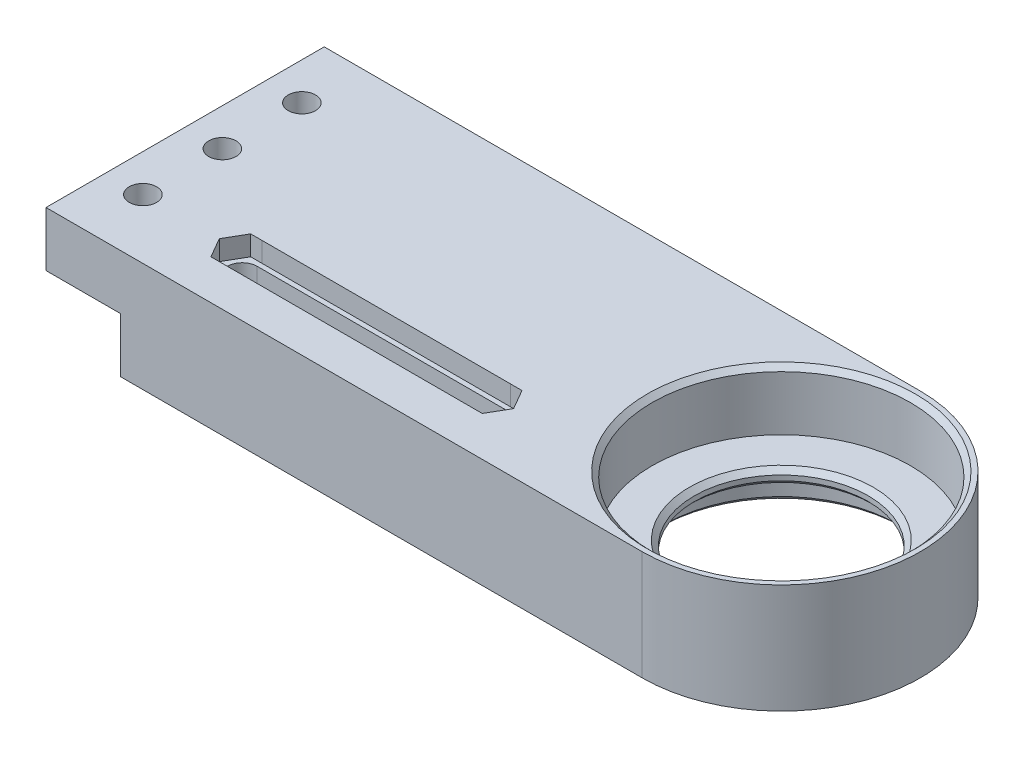
from build123d import *

# Parameters (mm, degrees)
EXTRUDE_1_DEPTH     = 22
CUT_EXTRUDE_1_REACH = 136.239
SKETCH_2_W          = 15
SKETCH_2_H          = 11
SKETCH_3_R          = 26
CUT_EXTRUDE_2_DEPTH = 12
CUT_EXTRUDE_3_REACH = 125.806
SKETCH_4_R          = 17.5
SKETCH_5_R          = 23.5
CUT_EXTRUDE_4_DEPTH = 7
CHAMFER_1_SIZE      = 1
CUT_EXTRUDE_5_REACH = 127.172
SKETCH_6_R          = 2.75
CUT_EXTRUDE_7_REACH = 127.172
CUT_EXTRUDE_8_DEPTH = 4


with BuildPart() as part:
    # 草图1 → 凸台-拉伸1 (new body)
    with BuildSketch(Plane(origin=(0, 0, 0), x_dir=(1, 0, 0), z_dir=(0, 1, 0))):
        with BuildLine():
            Line((0, 28), (-120, 28))
            Line((-120, 28), (-120, -28))
            Line((-120, -28), (0, -28))
            ThreePointArc((0, -28), (28, 0), (0, 28))
        make_face()
    extrude(amount=EXTRUDE_1_DEPTH)

    # 草图2 → 切除-拉伸1 (cut, up to next)
    with BuildSketch(Plane.XY.offset(28), mode=Mode.PRIVATE) as cut_extrude_1_sk1:
        with Locations((-112.5, 5.5)):
            Rectangle(SKETCH_2_W, SKETCH_2_H)
    cut_extrude_1_tool1 = extrude(cut_extrude_1_sk1.sketch, amount=-CUT_EXTRUDE_1_REACH, mode=Mode.PRIVATE) & part.part
    add(cut_extrude_1_tool1.solids().sort_by_distance((-112.5, 5.5, 28))[0], mode=Mode.SUBTRACT)

    # 草图3 → 切除-拉伸2 (cut)
    with BuildSketch(Plane(origin=(0, 22, 0), x_dir=(1, 0, 0), z_dir=(0, 1, 0))):
        with Locations(Location((0, 0, 0), (0, 0, 270))):
            Circle(SKETCH_3_R)
    extrude(amount=-CUT_EXTRUDE_2_DEPTH, mode=Mode.SUBTRACT)

    # 草图4 → 切除-拉伸3 (cut, up to next)
    with BuildSketch(Plane(origin=(0, 10, 0), x_dir=(1, 0, 0), z_dir=(0, 1, 0)), mode=Mode.PRIVATE) as cut_extrude_3_sk1:
        with Locations(Location((0, 0, 0), (0, 0, 270))):
            Circle(SKETCH_4_R)
    cut_extrude_3_tool1 = extrude(cut_extrude_3_sk1.sketch, amount=-CUT_EXTRUDE_3_REACH, mode=Mode.PRIVATE) & part.part
    add(cut_extrude_3_tool1.solids().sort_by_distance((0, 10, 0))[0], mode=Mode.SUBTRACT)

    # 草图5 → 切除-拉伸4 (cut)
    with BuildSketch(Plane.XZ):
        with Locations(Location((0, 0, 0), (0, 0, 270))):
            Circle(SKETCH_5_R)
    extrude(amount=-CUT_EXTRUDE_4_DEPTH, mode=Mode.SUBTRACT)

    # 倒角1
    chamfer_1_edges = [part.edges().sort_by_distance(p)[0] for p in [
        (0, 22, -26),
        (0, 10, -17.5),
        (0, 0, 23.5),
        (0, 7, -17.5),
    ]]
    chamfer(chamfer_1_edges, length=CHAMFER_1_SIZE)

    # 草图6 → 切除-拉伸5 (cut, up to next)
    with BuildSketch(Plane(origin=(0, 22, 0), x_dir=(1, 0, 0), z_dir=(0, 1, 0)), mode=Mode.PRIVATE) as cut_extrude_5_sk1:
        with Locations(Location((-112.5, 0, 0), (0, 0, 270))):
            Circle(SKETCH_6_R)
    cut_extrude_5_tool1 = extrude(cut_extrude_5_sk1.sketch, amount=-CUT_EXTRUDE_5_REACH, mode=Mode.PRIVATE) & part.part
    # 草图6 → 切除-拉伸5 (cut, up to next)
    with BuildSketch(Plane(origin=(0, 22, 0), x_dir=(1, 0, 0), z_dir=(0, 1, 0)), mode=Mode.PRIVATE) as cut_extrude_5_sk2:
        with Locations(Location((-112.5, 16, 0), (0, 0, 270))):
            Circle(SKETCH_6_R)
    cut_extrude_5_tool2 = extrude(cut_extrude_5_sk2.sketch, amount=-CUT_EXTRUDE_5_REACH, mode=Mode.PRIVATE) & part.part
    # 草图6 → 切除-拉伸5 (cut, up to next)
    with BuildSketch(Plane(origin=(0, 22, 0), x_dir=(1, 0, 0), z_dir=(0, 1, 0)), mode=Mode.PRIVATE) as cut_extrude_5_sk3:
        with Locations(Location((-112.5, -16, 0), (0, 0, 270))):
            Circle(SKETCH_6_R)
    cut_extrude_5_tool3 = extrude(cut_extrude_5_sk3.sketch, amount=-CUT_EXTRUDE_5_REACH, mode=Mode.PRIVATE) & part.part
    add(cut_extrude_5_tool1.solids().sort_by_distance((-112.5, 22, 0))[0], mode=Mode.SUBTRACT)
    add(cut_extrude_5_tool2.solids().sort_by_distance((-112.5, 22, -16))[0], mode=Mode.SUBTRACT)
    add(cut_extrude_5_tool3.solids().sort_by_distance((-112.5, 22, 16))[0], mode=Mode.SUBTRACT)

    # 草图8 → 切除-拉伸7 (cut, up to next)
    with BuildSketch(Plane(origin=(0, 22, 0), x_dir=(1, 0, 0), z_dir=(0, 1, 0)), mode=Mode.PRIVATE) as cut_extrude_7_sk1:
        with BuildLine():
            ThreePointArc((-42.5, -13), (-39.5, -16), (-42.5, -19))
            Line((-42.5, -19), (-92.5, -19))
            ThreePointArc((-92.5, -19), (-95.5, -16), (-92.5, -13))
            Line((-92.5, -13), (-42.5, -13))
        make_face()
    cut_extrude_7_tool1 = extrude(cut_extrude_7_sk1.sketch, amount=-CUT_EXTRUDE_7_REACH, mode=Mode.PRIVATE) & part.part
    add(cut_extrude_7_tool1.solids().sort_by_distance((-67.5, 22, 16))[0], mode=Mode.SUBTRACT)

    # 草图8<3> → 切除-拉伸8 (cut)
    with BuildSketch(Plane(origin=(0, 22, 0), x_dir=(1, 0, 0), z_dir=(0, 1, 0))):
        Polygon((-92.5, -12), (-42.5, -12), (-40.191634991, -12.001796941), (-37.883271378, -16), (-40.191636387, -19.998205479), (-42.5, -20), (-92.5, -20), (-94.808363613, -19.998205479), (-97.116728622, -16), (-94.808365009, -12.001796941), align=None)
    extrude(amount=-CUT_EXTRUDE_8_DEPTH, mode=Mode.SUBTRACT)


solid = part.part
